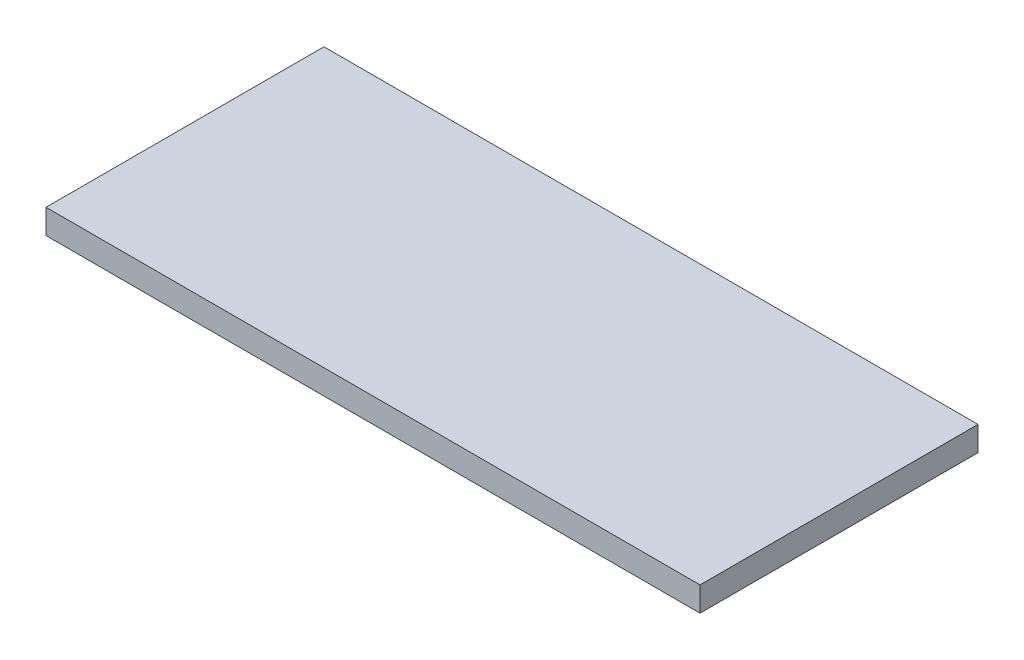
from build123d import *

# Parameters (mm, degrees)
SKETCH1_W           = 254
SKETCH1_H           = 107.95
BOSS_EXTRUDE1_DEPTH = 9.525


with BuildPart() as part:
    # Sketch1 → Boss-Extrude1 (new body)
    with BuildSketch(Plane(origin=(0, 0, 0), x_dir=(1, 0, 0), z_dir=(0, 1, 0))):
        Rectangle(SKETCH1_W, SKETCH1_H)
    extrude(amount=BOSS_EXTRUDE1_DEPTH)


solid = part.part
